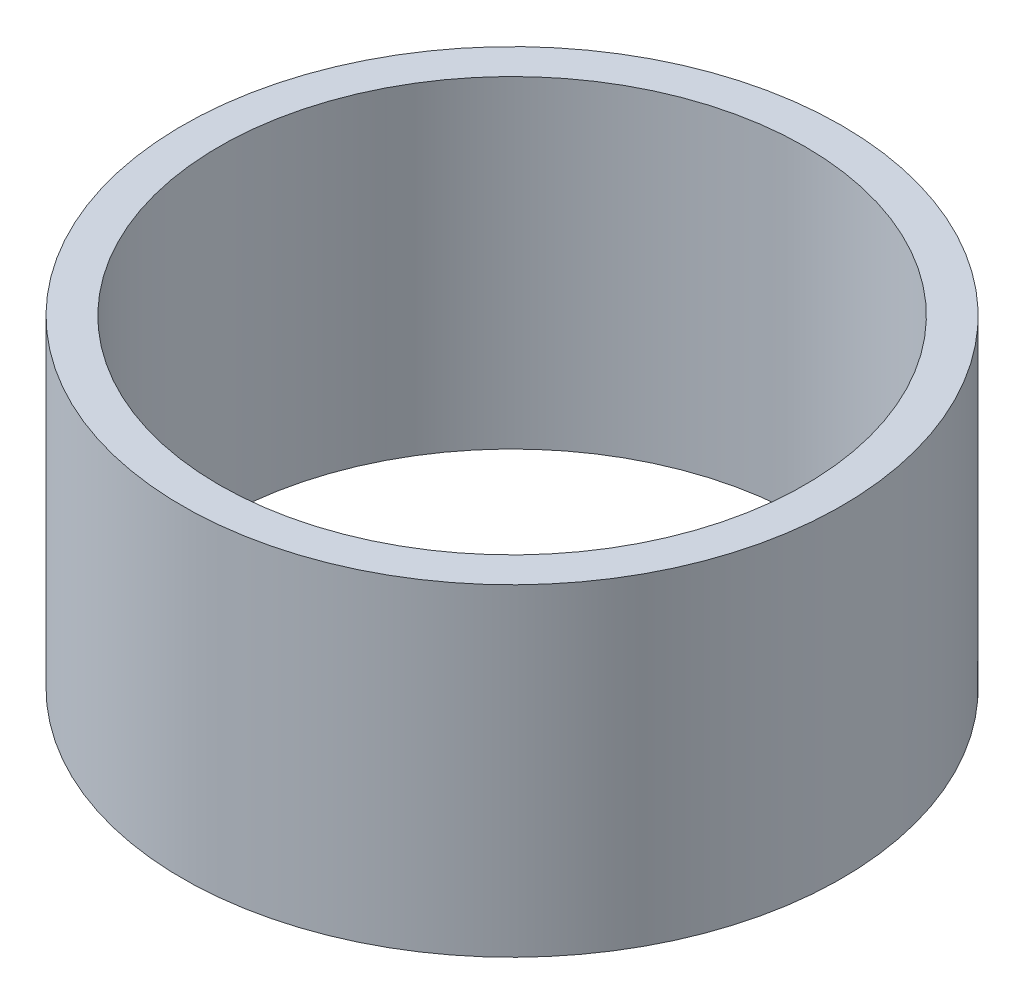
from build123d import *

# Parameters (mm, degrees)
SKETCH1_W = 1.5875
SKETCH1_H = 13.98499997


with BuildPart() as part:
    # Sketch1 → Revolve1 (revolve)
    with BuildSketch(Plane(origin=(0, 0, 0), x_dir=(0, 0, -1), z_dir=(1, 0, 0))):
        with Locations((13.49375, 6.992499985)):
            Rectangle(SKETCH1_W, SKETCH1_H)
    revolve(axis=Axis((0, 0, 0), (0, 1, 0)))


solid = part.part
